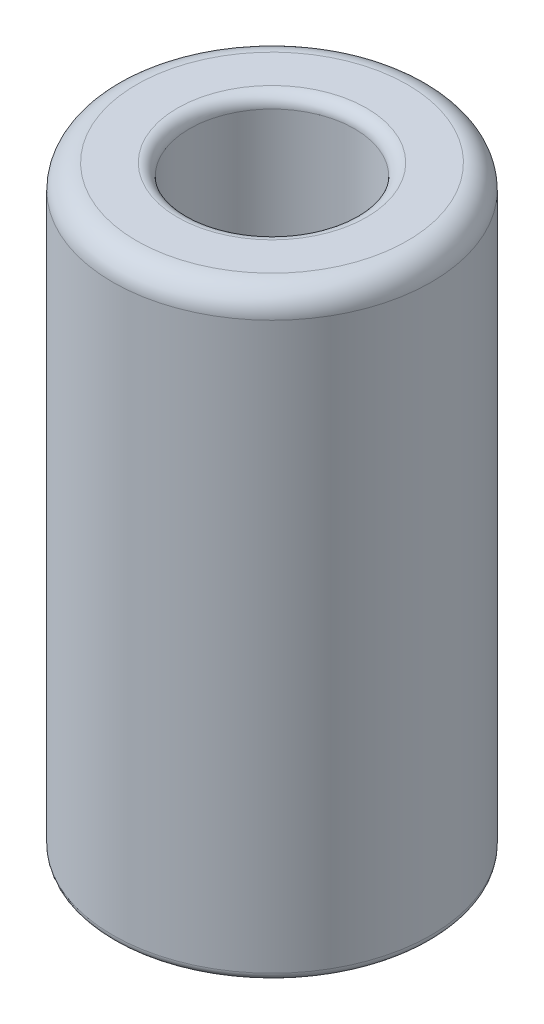
from build123d import *

# Parameters (mm, degrees)
SKETCH1_R           = 20
BOSS_EXTRUDE1_DEPTH = 35
SKETCH2_R           = 12.75
CUT_EXTRUDE1_DEPTH  = 35
SKETCH3_R           = 20
BOSS_EXTRUDE2_DEPTH = 5
SKETCH4_R           = 12.75
CUT_EXTRUDE2_DEPTH  = 10
CUT_EXTRUDE2_DRAFT  = -45
SKETCH5_R           = 20
BOSS_EXTRUDE3_DEPTH = 35
SKETCH6_R           = 10.375
CUT_EXTRUDE3_DEPTH  = 33
FILLET1_R           = 1.5
FILLET2_R           = 1.5
FILLET3_R           = 3
FILLET4_R           = 1


with BuildPart() as part:
    # Sketch1 → Boss-Extrude1 (new body)
    with BuildSketch(Plane(origin=(0, 0, 0), x_dir=(1, 0, 0), z_dir=(0, 1, 0))):
        with Locations(Location((0, 0, 0), (0, 0, 270))):
            Circle(SKETCH1_R)
    extrude(amount=BOSS_EXTRUDE1_DEPTH)

    # Sketch2 → Cut-Extrude1 (cut)
    with BuildSketch(Plane.XZ):
        with Locations(Location((0, 0, 0), (0, 0, 270))):
            Circle(SKETCH2_R)
    extrude(amount=-CUT_EXTRUDE1_DEPTH, mode=Mode.SUBTRACT)

    # Sketch3 → Boss-Extrude2 (add)
    with BuildSketch(Plane(origin=(0, 35, 0), x_dir=(1, 0, 0), z_dir=(0, 1, 0))):
        with Locations(Location((0, 0, 0), (0, 0, 270))):
            Circle(SKETCH3_R)
    extrude(amount=BOSS_EXTRUDE2_DEPTH)


with BuildPart() as cut_extrude2_tool:
    # Sketch4 → Cut-Extrude2 (with draft: the straight prism first)
    with BuildSketch(Plane.XZ.offset(-35)):
        with Locations(Location((0, 0, 0), (0, 0, 270))):
            Circle(SKETCH4_R)
    extrude(amount=-CUT_EXTRUDE2_DEPTH)
    # Cut-Extrude2: the draft: its side faces are tilted about the plane it starts from
    cut_extrude2_sides = [cut_extrude2_tool.faces().sort_by_distance(p)[0] for p in [
        (0, 40, 12.75),
    ]]
    draft(cut_extrude2_sides, Plane.XZ.offset(-35), CUT_EXTRUDE2_DRAFT)


with BuildPart() as part_1:
    add(part.part)

    # Cut-Extrude2: cut by cut_extrude2_tool
    add(cut_extrude2_tool.part, mode=Mode.SUBTRACT)

    # Sketch5 → Boss-Extrude3 (add)
    with BuildSketch(Plane(origin=(0, 40, 0), x_dir=(1, 0, 0), z_dir=(0, 1, 0))):
        with Locations(Location((0, 0, 0), (0, 0, 270))):
            Circle(SKETCH5_R)
    extrude(amount=BOSS_EXTRUDE3_DEPTH)

    # Sketch6 → Cut-Extrude3 (cut)
    with BuildSketch(Plane(origin=(0, 75, 0), x_dir=(1, 0, 0), z_dir=(0, 1, 0))):
        with Locations(Location((0, 0, 0), (0, 0, 270))):
            Circle(SKETCH6_R)
    extrude(amount=-CUT_EXTRUDE3_DEPTH, mode=Mode.SUBTRACT)

    # Fillet1
    fillet1_edges = [part_1.edges().sort_by_distance(p)[0] for p in [
        (0, 0, 12.75),
    ]]
    fillet(fillet1_edges, radius=FILLET1_R)

    # Fillet2
    fillet2_edges = [part_1.edges().sort_by_distance(p)[0] for p in [
        (0, 75, -10.375),
    ]]
    fillet(fillet2_edges, radius=FILLET2_R)

    # Fillet3
    fillet3_edges = [part_1.edges().sort_by_distance(p)[0] for p in [
        (0, 75, -20),
    ]]
    fillet(fillet3_edges, radius=FILLET3_R)

    # Fillet4
    fillet4_edges = [part_1.edges().sort_by_distance(p)[0] for p in [
        (0, 0, -20),
    ]]
    fillet(fillet4_edges, radius=FILLET4_R)


solid = part_1.part
